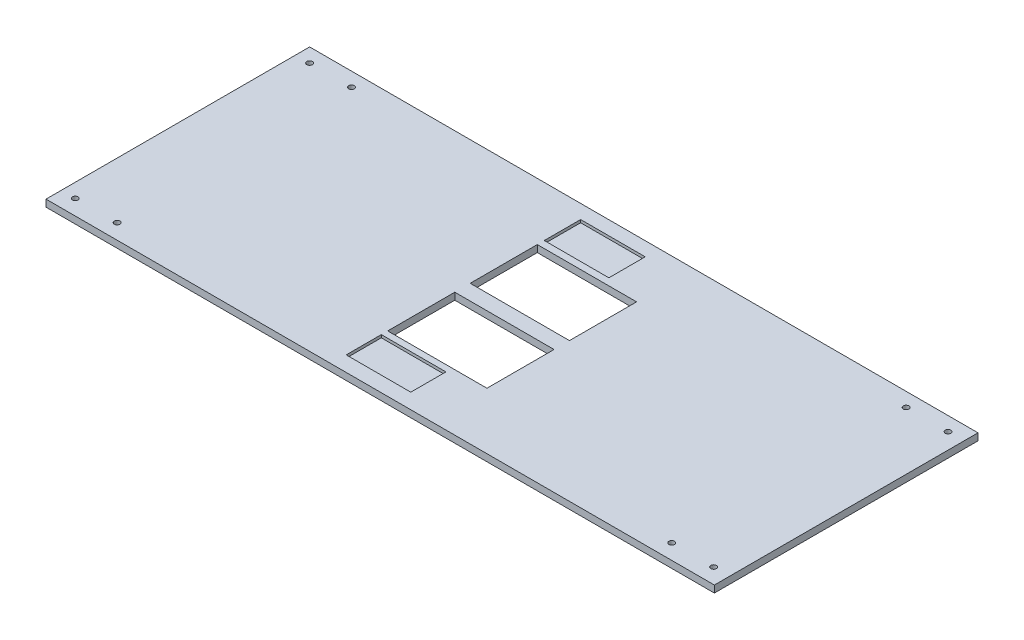
from build123d import *

# Parameters (mm, degrees)
ESQUISSE2_W        = 46.2
ESQUISSE2_H        = 5
ESQUISSE2_H_2      = 8
ESQUISSE2_H_3      = 8.88649877
ESQUISSE2_H_4      = 2
ESQUISSE2_H_5      = 4.567327767
BOSS_EXTRU_1_DEPTH = 5
ESQUISSE3_W        = 46.2
ESQUISSE3_H        = 25.11350123
ESQUISSE3_H_2      = 26
BOSS_EXTRU_2_DEPTH = 3


with BuildPart() as part:
    # Esquisse2 → Boss.-Extru.1 (new body)
    with BuildSketch(Plane(origin=(0, 0, 0), x_dir=(1, 0, 0), z_dir=(0, 1, 0))):
        with BuildLine():
            Line((-75.44494324, 137.861939651), (-85.44494324, 137.861939651))
            Line((-85.44494324, 137.861939651), (-85.44494324, 127.861939651))
            Line((-85.44494324, 127.861939651), (-77.44494324, 127.861939651))
            ThreePointArc((-77.44494324, 127.861939651), (-76.859156802, 129.276153213), (-75.44494324, 129.861939651))
            Line((-75.44494324, 129.861939651), (-75.44494324, 137.861939651))
        make_face()
        with BuildLine():
            Line((-77.44494324, 127.861939651), (-85.44494324, 127.861939651))
            Line((-85.44494324, 127.861939651), (-85.44494324, -39.841561579))
            Line((-85.44494324, -39.841561579), (-77.44494324, -39.841561579))
            ThreePointArc((-77.44494324, -39.841561579), (-76.859156802, -38.427348016), (-75.44494324, -37.841561579))
            Line((-75.44494324, -37.841561579), (-75.44494324, 125.861939651))
            ThreePointArc((-75.44494324, 125.861939651), (-76.859156802, 126.447726088), (-77.44494324, 127.861939651))
        make_face()
        with BuildLine():
            Line((-70.44494324, 127.861939651), (-73.44494324, 127.861939651))
            ThreePointArc((-73.44494324, 127.861939651), (-74.030729678, 126.447726088), (-75.44494324, 125.861939651))
            Line((-75.44494324, 125.861939651), (-75.44494324, -37.841561579))
            ThreePointArc((-75.44494324, -37.841561579), (-74.030729678, -38.427348016), (-73.44494324, -39.841561579))
            Line((-73.44494324, -39.841561579), (-70.44494324, -39.841561579))
            Line((-70.44494324, -39.841561579), (-70.44494324, 127.861939651))
        make_face()
        with BuildLine():
            Line((118.43505676, 101.861939651), (118.43505676, 127.861939651))
            Line((118.43505676, 127.861939651), (-43.44494324, 127.861939651))
            ThreePointArc((-43.44494324, 127.861939651), (-45.44494324, 125.861939651), (-47.44494324, 127.861939651))
            Line((-47.44494324, 127.861939651), (-70.44494324, 127.861939651))
            Line((-70.44494324, 127.861939651), (-70.44494324, -39.841561579))
            Line((-70.44494324, -39.841561579), (-47.44494324, -39.841561579))
            ThreePointArc((-47.44494324, -39.841561579), (-45.44494324, -37.841561579), (-43.44494324, -39.841561579))
            Line((-43.44494324, -39.841561579), (118.43505676, -39.841561579))
            Line((118.43505676, -39.841561579), (118.43505676, -35.312608687))
            Line((118.43505676, -35.312608687), (118.43505676, -14.728060349))
            Line((118.43505676, -14.728060349), (118.43505676, -10.160732582))
            Line((118.43505676, -10.160732582), (118.43505676, 33.566939651))
            Line((118.43505676, 33.566939651), (118.43505676, 37.839267418))
            Line((118.43505676, 37.839267418), (118.43505676, 48.861939651))
            Line((118.43505676, 48.861939651), (118.43505676, 53.566939651))
            Line((118.43505676, 53.566939651), (118.43505676, 96.861939651))
            Line((118.43505676, 96.861939651), (118.43505676, 101.861939651))
        make_face()
        with BuildLine():
            Line((-77.44494324, -39.841561579), (-85.44494324, -39.841561579))
            Line((-85.44494324, -39.841561579), (-85.44494324, -50.728060349))
            Line((-85.44494324, -50.728060349), (-75.44494324, -50.728060349))
            Line((-75.44494324, -50.728060349), (-75.44494324, -41.841561579))
            ThreePointArc((-75.44494324, -41.841561579), (-76.859156802, -41.255775141), (-77.44494324, -39.841561579))
        make_face()
        with BuildLine():
            Line((-75.44494324, -41.841561579), (-75.44494324, -50.728060349))
            Line((-75.44494324, -50.728060349), (118.43505676, -50.728060349))
            Line((118.43505676, -50.728060349), (118.43505676, -48.728060349))
            Line((118.43505676, -48.728060349), (118.43505676, -39.841561579))
            Line((118.43505676, -39.841561579), (-43.44494324, -39.841561579))
            ThreePointArc((-43.44494324, -39.841561579), (-45.44494324, -41.841561579), (-47.44494324, -39.841561579))
            Line((-47.44494324, -39.841561579), (-70.44494324, -39.841561579))
            Line((-70.44494324, -39.841561579), (-73.44494324, -39.841561579))
            ThreePointArc((-73.44494324, -39.841561579), (-74.030729678, -41.255775141), (-75.44494324, -41.841561579))
        make_face()
        with BuildLine():
            Line((349.300456076, 127.861939651), (164.63505676, 127.861939651))
            Line((164.63505676, 127.861939651), (164.63505676, 101.861939651))
            Line((164.63505676, 101.861939651), (164.63505676, 96.861939651))
            Line((164.63505676, 96.861939651), (189.43505676, 96.861939651))
            Line((189.43505676, 96.861939651), (189.43505676, 48.861939651))
            Line((189.43505676, 48.861939651), (164.63505676, 48.861939651))
            Line((164.63505676, 48.861939651), (164.63505676, 43.566939651))
            Line((164.63505676, 43.566939651), (164.63505676, 37.839267418))
            Line((164.63505676, 37.839267418), (189.43505676, 37.839267418))
            Line((189.43505676, 37.839267418), (189.43505676, -10.160732582))
            Line((189.43505676, -10.160732582), (164.63505676, -10.160732582))
            Line((164.63505676, -10.160732582), (164.63505676, -14.728060349))
            Line((164.63505676, -14.728060349), (164.63505676, -39.841561579))
            Line((164.63505676, -39.841561579), (349.300456076, -39.841561579))
            ThreePointArc((349.300456076, -39.841561579), (351.300456076, -37.841561579), (353.300456076, -39.841561579))
            Line((353.300456076, -39.841561579), (377.70505676, -39.841561579))
            Line((377.70505676, -39.841561579), (377.70505676, 127.861939651))
            Line((377.70505676, 127.861939651), (353.300456076, 127.861939651))
            ThreePointArc((353.300456076, 127.861939651), (351.300456076, 125.861939651), (349.300456076, 127.861939651))
        make_face()
        with BuildLine():
            Line((381.300456076, 137.861939651), (118.43505676, 137.861939651))
            Line((118.43505676, 137.861939651), (118.43505676, 135.861939651))
            Line((118.43505676, 135.861939651), (164.63505676, 135.861939651))
            Line((164.63505676, 135.861939651), (164.63505676, 127.861939651))
            Line((164.63505676, 127.861939651), (349.300456076, 127.861939651))
            ThreePointArc((349.300456076, 127.861939651), (351.300456076, 129.861939651), (353.300456076, 127.861939651))
            Line((353.300456076, 127.861939651), (377.70505676, 127.861939651))
            Line((377.70505676, 127.861939651), (379.300456076, 127.861939651))
            ThreePointArc((379.300456076, 127.861939651), (379.886242514, 129.276153213), (381.300456076, 129.861939651))
            Line((381.300456076, 129.861939651), (381.300456076, 137.861939651))
        make_face()
        with BuildLine():
            Line((392.70505676, -39.841561579), (392.70505676, 127.861939651))
            Line((392.70505676, 127.861939651), (383.300456076, 127.861939651))
            ThreePointArc((383.300456076, 127.861939651), (382.714669639, 126.447726088), (381.300456076, 125.861939651))
            Line((381.300456076, 125.861939651), (381.300456076, -37.841561579))
            ThreePointArc((381.300456076, -37.841561579), (382.714669639, -38.427348016), (383.300456076, -39.841561579))
            Line((383.300456076, -39.841561579), (392.70505676, -39.841561579))
        make_face()
        with BuildLine():
            Line((392.70505676, 137.861939651), (381.300456076, 137.861939651))
            Line((381.300456076, 137.861939651), (381.300456076, 129.861939651))
            ThreePointArc((381.300456076, 129.861939651), (382.714669639, 129.276153213), (383.300456076, 127.861939651))
            Line((383.300456076, 127.861939651), (392.70505676, 127.861939651))
            Line((392.70505676, 127.861939651), (392.70505676, 137.861939651))
        make_face()
        Polygon((164.63505676, 48.861939651), (118.43505676, 48.861939651), (118.43505676, 37.839267418), (164.63505676, 37.839267418), (164.63505676, 43.566939651), align=None)
        with Locations((141.53505676, 99.361939651)):
            Rectangle(ESQUISSE2_W, ESQUISSE2_H)
        with Locations((141.53505676, 131.861939651)):
            Rectangle(ESQUISSE2_W, ESQUISSE2_H_2)
        with BuildLine():
            Line((118.43505676, 137.861939651), (-75.44494324, 137.861939651))
            Line((-75.44494324, 137.861939651), (-75.44494324, 129.861939651))
            ThreePointArc((-75.44494324, 129.861939651), (-74.030729678, 129.276153213), (-73.44494324, 127.861939651))
            Line((-73.44494324, 127.861939651), (-70.44494324, 127.861939651))
            Line((-70.44494324, 127.861939651), (-47.44494324, 127.861939651))
            ThreePointArc((-47.44494324, 127.861939651), (-45.44494324, 129.861939651), (-43.44494324, 127.861939651))
            Line((-43.44494324, 127.861939651), (118.43505676, 127.861939651))
            Line((118.43505676, 127.861939651), (118.43505676, 135.861939651))
            Line((118.43505676, 135.861939651), (118.43505676, 137.861939651))
        make_face()
        with Locations((141.53505676, -44.284810964)):
            Rectangle(ESQUISSE2_W, ESQUISSE2_H_3)
        with Locations((141.53505676, -49.728060349)):
            Rectangle(ESQUISSE2_W, ESQUISSE2_H_4)
        with BuildLine():
            Line((164.63505676, -48.728060349), (164.63505676, -50.728060349))
            Line((164.63505676, -50.728060349), (377.70505676, -50.728060349))
            Line((377.70505676, -50.728060349), (377.70505676, -39.841561579))
            Line((377.70505676, -39.841561579), (353.300456076, -39.841561579))
            ThreePointArc((353.300456076, -39.841561579), (351.300456076, -41.841561579), (349.300456076, -39.841561579))
            Line((349.300456076, -39.841561579), (164.63505676, -39.841561579))
            Line((164.63505676, -39.841561579), (164.63505676, -48.728060349))
        make_face()
        with Locations((141.53505676, -12.444396466)):
            Rectangle(ESQUISSE2_W, ESQUISSE2_H_5)
        with BuildLine():
            Line((379.300456076, -39.841561579), (377.70505676, -39.841561579))
            Line((377.70505676, -39.841561579), (377.70505676, -50.728060349))
            Line((377.70505676, -50.728060349), (381.300456076, -50.728060349))
            Line((381.300456076, -50.728060349), (381.300456076, -41.841561579))
            ThreePointArc((381.300456076, -41.841561579), (379.886242514, -41.255775141), (379.300456076, -39.841561579))
        make_face()
        with BuildLine():
            Line((392.70505676, -50.728060349), (392.70505676, -39.841561579))
            Line((392.70505676, -39.841561579), (383.300456076, -39.841561579))
            ThreePointArc((383.300456076, -39.841561579), (382.714669639, -41.255775141), (381.300456076, -41.841561579))
            Line((381.300456076, -41.841561579), (381.300456076, -50.728060349))
            Line((381.300456076, -50.728060349), (392.70505676, -50.728060349))
        make_face()
        with BuildLine():
            ThreePointArc((381.300456076, 125.861939651), (379.886242514, 126.447726088), (379.300456076, 127.861939651))
            Line((379.300456076, 127.861939651), (377.70505676, 127.861939651))
            Line((377.70505676, 127.861939651), (377.70505676, -39.841561579))
            Line((377.70505676, -39.841561579), (379.300456076, -39.841561579))
            ThreePointArc((379.300456076, -39.841561579), (379.886242514, -38.427348016), (381.300456076, -37.841561579))
            Line((381.300456076, -37.841561579), (381.300456076, 125.861939651))
        make_face()
    extrude(amount=BOSS_EXTRU_1_DEPTH)

    # Esquisse3 → Boss.-Extru.2 (add)
    with BuildSketch(Plane.XZ):
        with Locations((141.53505676, 27.284810964)):
            Rectangle(ESQUISSE3_W, ESQUISSE3_H)
        with Locations((141.53505676, -114.861939651)):
            Rectangle(ESQUISSE3_W, ESQUISSE3_H_2)
    extrude(amount=-BOSS_EXTRU_2_DEPTH)


solid = part.part
